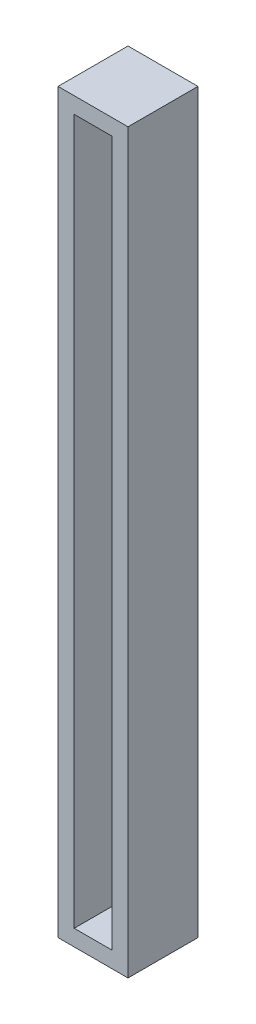
from build123d import *

# Parameters (mm, degrees)
SKETCH1_W           = 6.5
SKETCH1_H           = 68.5
SKETCH1_W_2         = 3.5
SKETCH1_H_2         = 65.5
BOSS_EXTRUDE1_DEPTH = 6
SKETCH2_W           = 6.5
SKETCH2_H           = 68.5
BOSS_EXTRUDE2_DEPTH = 0.5
BOSS_EXTRUDE3_DEPTH = 1


with BuildPart() as part:
    # Sketch1 → Boss-Extrude1 (new body)
    with BuildSketch(Plane.XY):
        with Locations((3.25, 34.25)):
            Rectangle(SKETCH1_W, SKETCH1_H)
        with Locations((3.25, 34.25)):
            Rectangle(SKETCH1_W_2, SKETCH1_H_2, mode=Mode.SUBTRACT)
    extrude(amount=BOSS_EXTRUDE1_DEPTH)

    # Sketch2 → Boss-Extrude2 (add)
    with BuildSketch(Plane(origin=(0, 0, 0), x_dir=(-1, 0, 0), z_dir=(0, 0, -1))):
        with Locations((-3.25, 34.25)):
            Rectangle(SKETCH2_W, SKETCH2_H)
    extrude(amount=BOSS_EXTRUDE2_DEPTH)

    # Sketch3 → Boss-Extrude3 (add)
    with BuildSketch(Plane.ZY):
        with BuildLine():
            Line((1, 64), (1.5, 64))
            ThreePointArc((1.5, 64), (1.853553391, 63.853553391), (2, 63.5))
            Line((2, 63.5), (2, 63))
            ThreePointArc((2, 63), (1.853553391, 62.646446609), (1.5, 62.5))
            Line((1.5, 62.5), (1, 62.5))
            ThreePointArc((1, 62.5), (0.646446609, 62.646446609), (0.5, 63))
            Line((0.5, 63), (0.5, 63.5))
            ThreePointArc((0.5, 63.5), (0.646446609, 63.853553391), (1, 64))
        make_face()
        with BuildLine():
            Line((1, 6), (1.5, 6))
            ThreePointArc((1.5, 6), (1.853553391, 5.853553391), (2, 5.5))
            Line((2, 5.5), (2, 5))
            ThreePointArc((2, 5), (1.853553391, 4.646446609), (1.5, 4.5))
            Line((1.5, 4.5), (1, 4.5))
            ThreePointArc((1, 4.5), (0.646446609, 4.646446609), (0.5, 5))
            Line((0.5, 5), (0.5, 5.5))
            ThreePointArc((0.5, 5.5), (0.646446609, 5.853553391), (1, 6))
        make_face()
    extrude(amount=BOSS_EXTRUDE3_DEPTH)


solid = part.part
